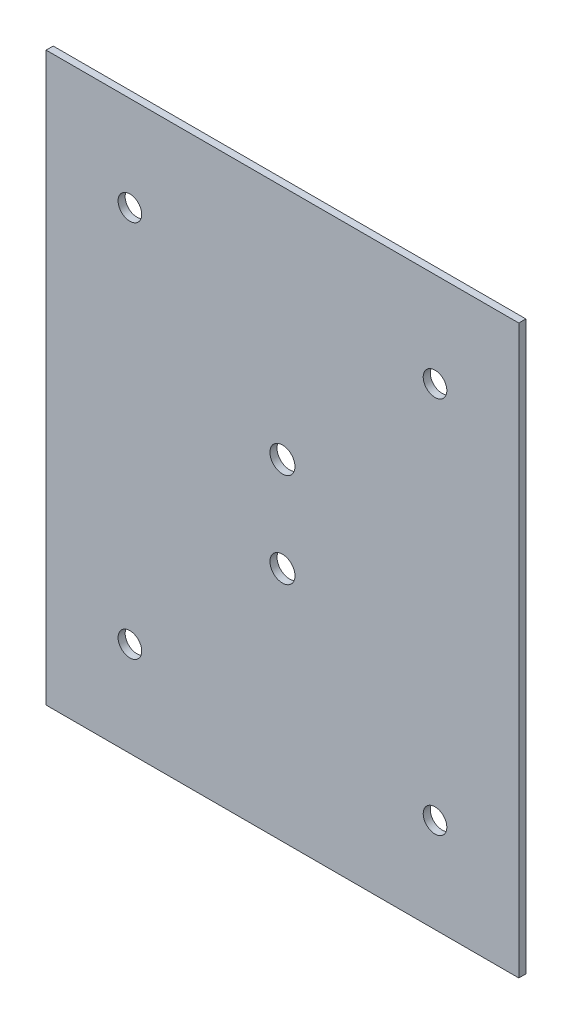
from build123d import *

# Parameters (mm, degrees)
SKETCH1_W           = 100
SKETCH1_H           = 120
BOSS_EXTRUDE1_DEPTH = 1.5
SKETCH2_R           = 2.5
CUT_EXTRUDE1_DEPTH  = 1.5
SKETCH4_R           = 2.65
CUT_EXTRUDE2_DEPTH  = 1.5


with BuildPart() as part:
    # Sketch1 → Boss-Extrude1 (new body)
    with BuildSketch(Plane.XY):
        with Locations((50, 60)):
            Rectangle(SKETCH1_W, SKETCH1_H)
    extrude(amount=BOSS_EXTRUDE1_DEPTH)

    # Sketch2 → Cut-Extrude1 (cut)
    with BuildSketch(Plane(origin=(0, 0, 0), x_dir=(-1, 0, 0), z_dir=(0, 0, -1))):
        with Locations((-82.275, 20)):
            Circle(SKETCH2_R)
        with Locations((-17.725, 20)):
            Circle(SKETCH2_R)
        with Locations((-17.725, 100)):
            Circle(SKETCH2_R)
        with Locations((-82.275, 100)):
            Circle(SKETCH2_R)
    extrude(amount=-CUT_EXTRUDE1_DEPTH, mode=Mode.SUBTRACT)

    # Sketch4 → Cut-Extrude2 (cut)
    with BuildSketch(Plane.XY.offset(1.5)):
        with Locations((50, 50)):
            Circle(SKETCH4_R)
        with Locations((50, 70)):
            Circle(SKETCH4_R)
    extrude(amount=-CUT_EXTRUDE2_DEPTH, mode=Mode.SUBTRACT)


solid = part.part
